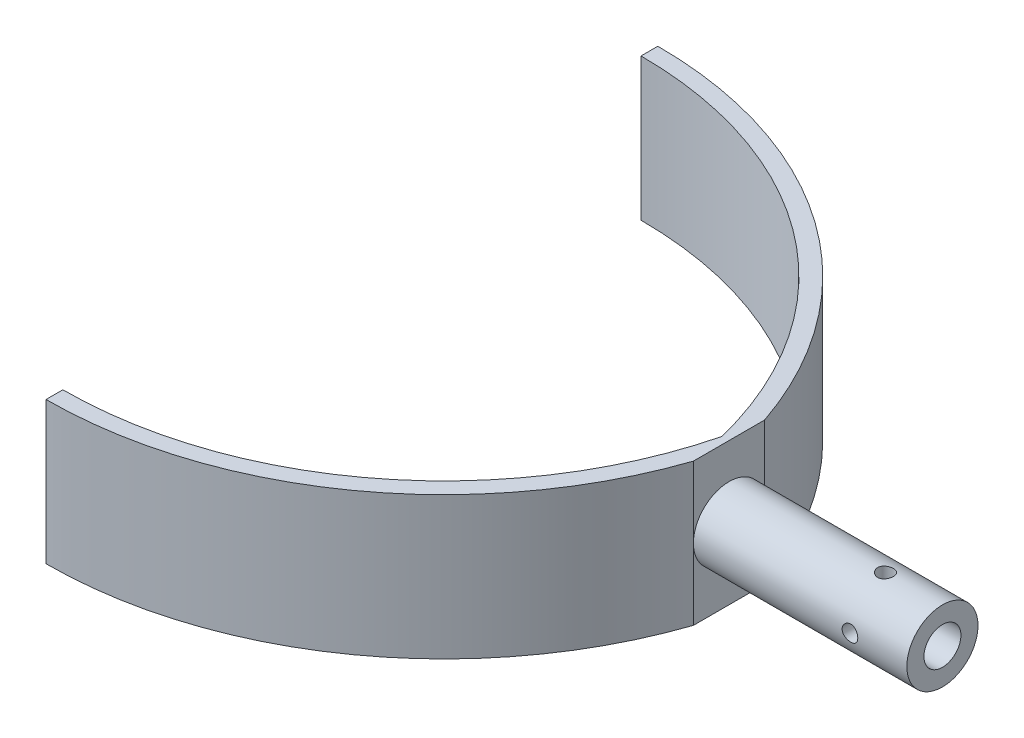
from build123d import *

# Parameters (mm, degrees)
SKETCH1_R                = 5
BOSS_EXTRUDE1_DEPTH      = 25
SKETCH2_R                = 2.6
CUT_EXTRUDE1_DEPTH       = 25
CUT_EXTRUDE3_DEPTH       = 25
CUT_EXTRUDE3_DEPTH_BACK  = 25
SKETCH3_R                = 1.1
CUT_EXTRUDE4_DEPTH       = 25
CUT_EXTRUDE4_DEPTH_BACK  = 25
SKETCH4_R                = 1.1
BOSS_EXTRUDE3_START      = 5
SKETCH6_R                = 5
BOSS_EXTRUDE3_DEPTH      = 5
BOSS_EXTRUDE2_DEPTH      = 10
BOSS_EXTRUDE2_DEPTH_BACK = 10


with BuildPart() as part:
    # Sketch1 → Boss-Extrude1 (new body)
    with BuildSketch(Plane(origin=(0, 0, 0), x_dir=(0, 0, -1), z_dir=(1, 0, 0))):
        Circle(SKETCH1_R)
    extrude(amount=BOSS_EXTRUDE1_DEPTH)

    # Sketch2 → Cut-Extrude1 (cut)
    with BuildSketch(Plane.ZY):
        Circle(SKETCH2_R)
    extrude(amount=-CUT_EXTRUDE1_DEPTH, mode=Mode.SUBTRACT)

    # Sketch3 → Cut-Extrude3 (cut, two sides: drawn at the far end of the back side and taken through both)
    with BuildSketch(Plane(origin=(0, 0, 0), x_dir=(1, 0, 0), z_dir=(0, 1, 0)).offset(-CUT_EXTRUDE3_DEPTH_BACK)):
        with Locations((17, 0)):
            Circle(SKETCH3_R)
    extrude(amount=CUT_EXTRUDE3_DEPTH + CUT_EXTRUDE3_DEPTH_BACK, mode=Mode.SUBTRACT)

    # Sketch4 → Cut-Extrude4 (cut, two sides: drawn at the far end of the back side and taken through both)
    with BuildSketch(Plane.XY.offset(-CUT_EXTRUDE4_DEPTH_BACK)):
        with Locations((17, 0)):
            Circle(SKETCH4_R)
    extrude(amount=CUT_EXTRUDE4_DEPTH + CUT_EXTRUDE4_DEPTH_BACK, mode=Mode.SUBTRACT)

    # Sketch6 → Boss-Extrude3 (add)
    with BuildSketch(Plane.ZY.offset(BOSS_EXTRUDE3_START)):
        Circle(SKETCH6_R)
    extrude(amount=-BOSS_EXTRUDE3_DEPTH)

    # Sketch5 → Boss-Extrude2 (add, two sides: drawn at the far end of the back side and taken through both)
    with BuildSketch(Plane(origin=(0, 0, 0), x_dir=(1, 0, 0), z_dir=(0, 1, 0)).offset(-BOSS_EXTRUDE2_DEPTH_BACK)):
        with BuildLine():
            Line((-58, -40.633969476), (-58, -43))
            ThreePointArc((-58, -43), (-25.392485529, -32.518375447), (-5, -5))
            Line((-5, -5), (-5, 5))
            ThreePointArc((-5, 5), (-25.392485529, 32.518375447), (-58, 43))
            Line((-58, 43), (-58, 40.633969476))
            ThreePointArc((-58, 40.633969476), (-25.001840156, 29.270877002), (-5.996204592, 0))
            ThreePointArc((-5.996204592, 0), (-25.001840156, -29.270877002), (-58, -40.633969476))
        make_face()
    extrude(amount=BOSS_EXTRUDE2_DEPTH + BOSS_EXTRUDE2_DEPTH_BACK)


solid = part.part
